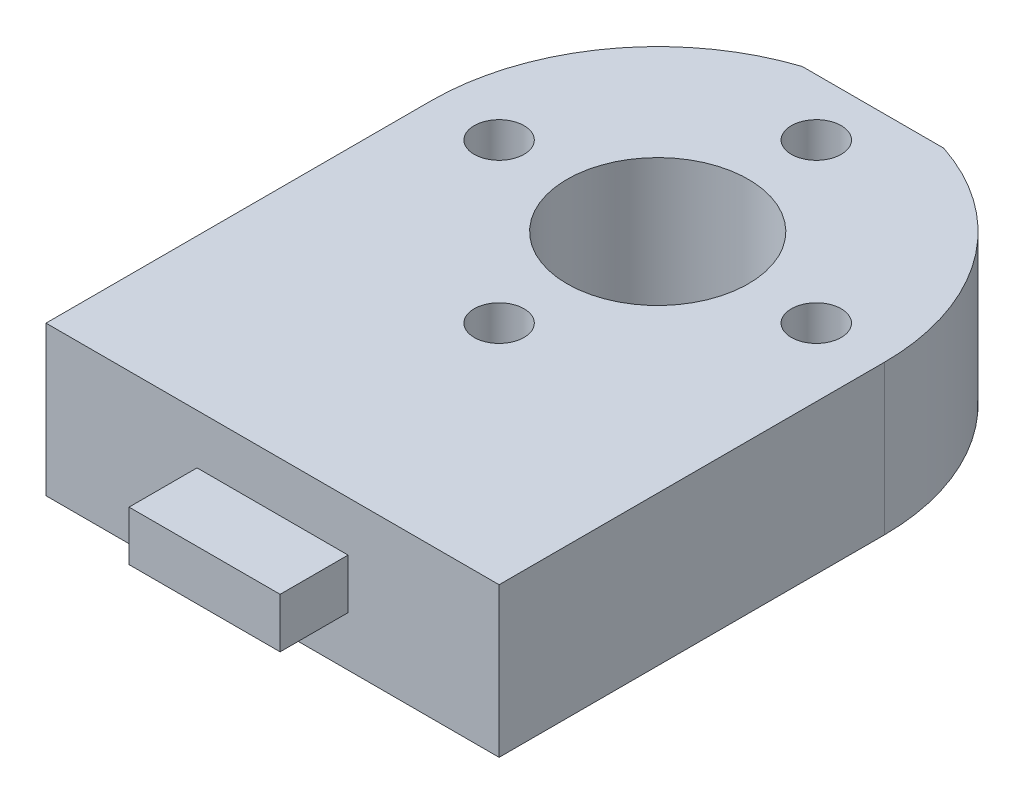
from build123d import *

# Parameters (mm, degrees)
SKETCH_1_R      = 4
SKETCH_1_R_2    = 1.1
EXTRUDE_2_DEPTH = 6.6
SKETCH_2_W      = 6.666666666
SKETCH_2_H      = 2.2
EXTRUDE_3_DEPTH = 3


with BuildPart() as part:
    # 草图1 → 凸台-拉伸2 (new body)
    with BuildSketch(Plane(origin=(0, 0, 0), x_dir=(1, 0, 0), z_dir=(0, 1, 0))):
        with BuildLine():
            Line((-10, -17), (10, -17))
            Line((10, -17), (10, 0))
            ThreePointArc((10, 0), (8.100154011, 5.864086033), (3.122498999, 9.5))
            Line((3.122498999, 9.5), (-3.122498999, 9.5))
            ThreePointArc((-3.122498999, 9.5), (-8.100154011, 5.864086033), (-10, 0))
            Line((-10, 0), (-10, -17))
        make_face()
        with Locations(Location((0, 0, 0), (0, 0, 270))):
            Circle(SKETCH_1_R, mode=Mode.SUBTRACT)
        with Locations(Location((-7, 0, 0), (0, 0, 270))):
            Circle(SKETCH_1_R_2, mode=Mode.SUBTRACT)
        with Locations(Location((0, 7, 0), (0, 0, 270))):
            Circle(SKETCH_1_R_2, mode=Mode.SUBTRACT)
        with Locations(Location((7, 0, 0), (0, 0, 270))):
            Circle(SKETCH_1_R_2, mode=Mode.SUBTRACT)
        with Locations(Location((0, -7, 0), (0, 0, 270))):
            Circle(SKETCH_1_R_2, mode=Mode.SUBTRACT)
    extrude(amount=EXTRUDE_2_DEPTH)

    # 草图2 → 凸台-拉伸3 (add)
    with BuildSketch(Plane.XY.offset(17)):
        with Locations((0, 3.3)):
            Rectangle(SKETCH_2_W, SKETCH_2_H)
    extrude(amount=EXTRUDE_3_DEPTH)


solid = part.part
